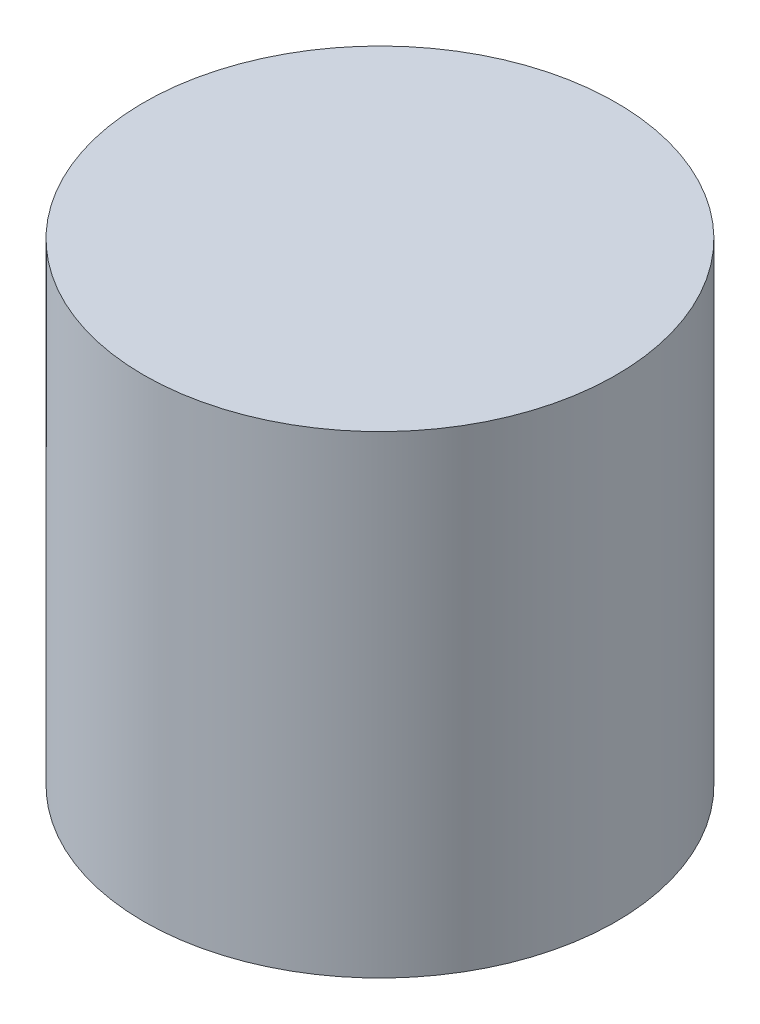
from build123d import *

# Parameters (mm, degrees)
SKETCH_1_R      = 4.99
EXTRUDE_2_DEPTH = 10


with BuildPart() as part:
    # 草图1 → 凸台-拉伸2 (new body)
    with BuildSketch(Plane(origin=(0, 0, 0), x_dir=(1, 0, 0), z_dir=(0, 1, 0))):
        with Locations(Location((0, 0, 0), (0, 0, 270))):
            Circle(SKETCH_1_R)
    extrude(amount=EXTRUDE_2_DEPTH)


solid = part.part
